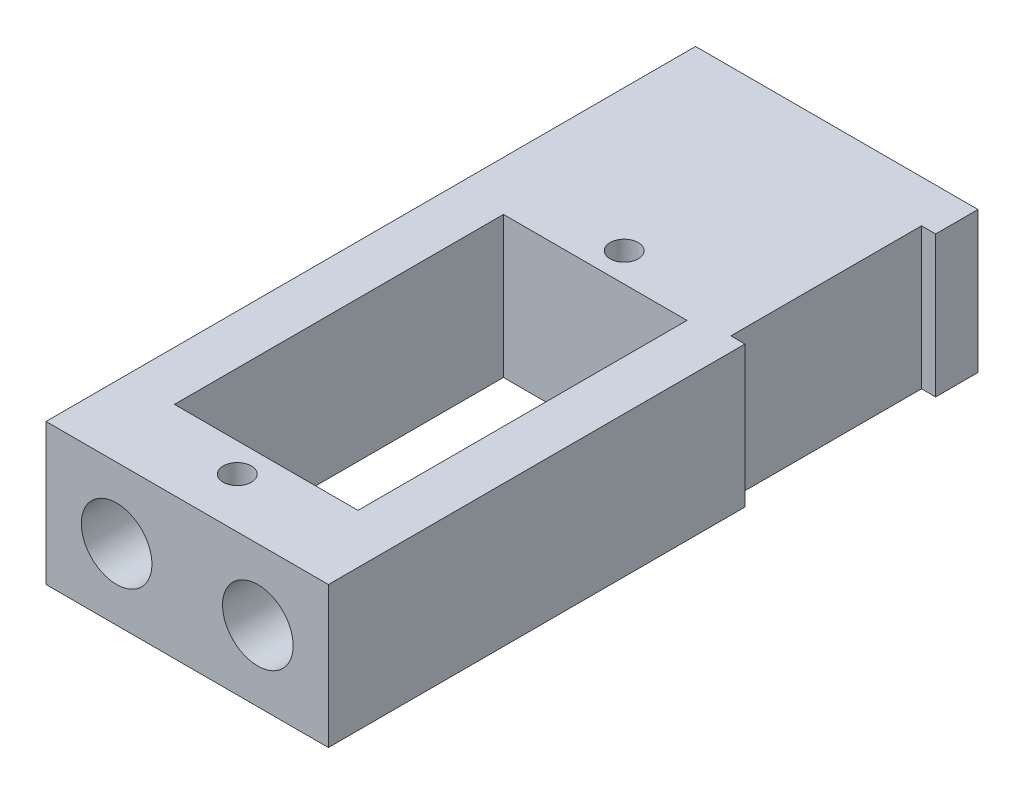
from build123d import *

# Parameters (mm, degrees)
SKETCH1_W           = 20
SKETCH1_H           = 46
BOSS_EXTRUDE1_DEPTH = 10
SKETCH2_R           = 1
SKETCH2_W           = 13
SKETCH2_H           = 23.3
CUT_EXTRUDE1_DEPTH  = 28
SKETCH3_R           = 2.5
CUT_EXTRUDE2_DEPTH  = 4
CUT_EXTRUDE3_START  = -4
SKETCH4_R           = 2.5
CUT_EXTRUDE3_DEPTH  = 4
SKETCH5_W           = 13.5
SKETCH5_H           = 10
CUT_EXTRUDE4_DEPTH  = 1


with BuildPart() as part:
    # Sketch1 → Boss-Extrude1 (new body)
    with BuildSketch(Plane(origin=(0, 0, 0), x_dir=(1, 0, 0), z_dir=(0, 1, 0))):
        Rectangle(SKETCH1_W, SKETCH1_H)
    extrude(amount=BOSS_EXTRUDE1_DEPTH)

    # Sketch2 → Cut-Extrude1 (cut, through all)
    with BuildSketch(Plane(origin=(0, 10, 0), x_dir=(1, 0, 0), z_dir=(0, 1, 0))):
        with Locations(Location((0, 7.945, 0), (0, 0, 270))):
            Circle(SKETCH2_R)
        with Locations(Location((0, -19.455, 0), (0, 0, 90))):
            Circle(SKETCH2_R)
        with Locations((0, -5.755)):
            Rectangle(SKETCH2_W, SKETCH2_H)
    extrude(amount=-CUT_EXTRUDE1_DEPTH, mode=Mode.SUBTRACT)

    # Sketch3 → Cut-Extrude2 (cut)
    with BuildSketch(Plane(origin=(0, 0, -23), x_dir=(-1, 0, 0), z_dir=(0, 0, -1))):
        with Locations((5, 5)):
            Circle(SKETCH3_R)
        with Locations(Location((-5, 5, 0), (0, 0, 180))):
            Circle(SKETCH3_R)
    extrude(amount=-CUT_EXTRUDE2_DEPTH, mode=Mode.SUBTRACT)

    # Sketch4 → Cut-Extrude3 (cut)
    with BuildSketch(Plane.XY.offset(23).offset(CUT_EXTRUDE3_START)):
        with Locations((5, 5)):
            Circle(SKETCH4_R)
        with Locations(Location((-5, 5, 0), (0, 0, 180))):
            Circle(SKETCH4_R)
    extrude(amount=CUT_EXTRUDE3_DEPTH, mode=Mode.SUBTRACT)

    # Sketch5 → Cut-Extrude4 (cut)
    with BuildSketch(Plane(origin=(10, 0, 0), x_dir=(0, 0, -1), z_dir=(1, 0, 0))):
        with Locations((13.25, 5)):
            Rectangle(SKETCH5_W, SKETCH5_H)
    extrude(amount=-CUT_EXTRUDE4_DEPTH, mode=Mode.SUBTRACT)


solid = part.part
